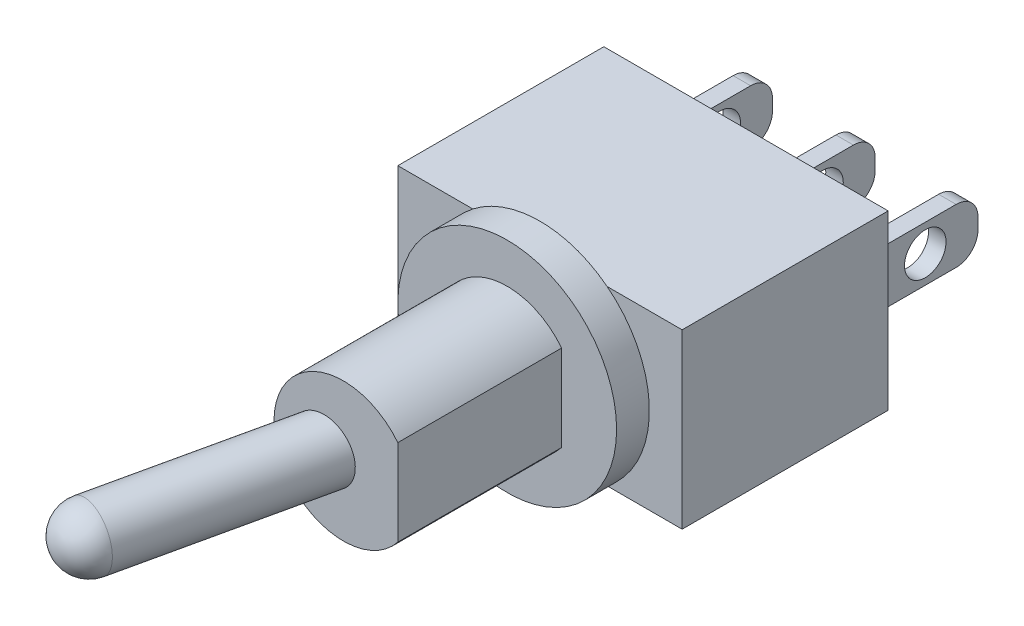
from build123d import *

# Parameters (mm, degrees)
SKETCH2_W           = 13.0048
SKETCH2_H           = 7.8994
BOSS_EXTRUDE1_DEPTH = 9.4234
BOSS_EXTRUDE2_START = 4.7
SKETCH5_R           = 0.95
BOSS_EXTRUDE2_DEPTH = 0.4
LPATTERN1_COUNT     = 3
LPATTERN1_PITCH     = 4.7
SKETCH6_R           = 5.0038
BOSS_EXTRUDE3_DEPTH = 1.4986
BOSS_EXTRUDE5_DEPTH = 7.493


with BuildPart() as part:
    # Sketch2 → Boss-Extrude1 (new body)
    with BuildSketch(Plane.XY):
        Rectangle(SKETCH2_W, SKETCH2_H)
    extrude(amount=-BOSS_EXTRUDE1_DEPTH)

    # Sketch5 → Boss-Extrude2 (add, symmetric)
    with BuildSketch(Plane(origin=(0, 0, 0), x_dir=(0, 0, -1), z_dir=(1, 0, 0)).offset(BOSS_EXTRUDE2_START)):
        with BuildLine():
            ThreePointArc((13.9352, 1.25), (14.642306781, 0.957106781), (14.9352, 0.25))
            Line((14.9352, 0.25), (14.9352, -0.25))
            ThreePointArc((14.9352, -0.25), (14.642306781, -0.957106781), (13.9352, -1.25))
            Line((13.9352, -1.25), (9.4234, -1.25))
            Line((9.4234, -1.25), (9.4234, 1.25))
            Line((9.4234, 1.25), (13.9352, 1.25))
        make_face()
        with Locations((12.5234, 0)):
            Circle(SKETCH5_R, mode=Mode.SUBTRACT)
    boss_extrude2 = extrude(amount=BOSS_EXTRUDE2_DEPTH, both=True)

    # LPattern1: Boss-Extrude2 ×3
    with Locations(*[(-i * LPATTERN1_PITCH, 0, 0) for i in range(1, LPATTERN1_COUNT)]):
        add(boss_extrude2)

    # Sketch6 → Boss-Extrude3 (add)
    with BuildSketch(Plane.XY):
        with Locations(Location((0, 0, 0), (0, 0, 127.876114344))):
            Circle(SKETCH6_R)
    extrude(amount=BOSS_EXTRUDE3_DEPTH)

    # Sketch7 → Boss-Extrude5 (add)
    with BuildSketch(Plane.XY.offset(1.4986)):
        with BuildLine():
            Line((2.4892, -1.970915615), (2.4892, 1.970915615))
            ThreePointArc((2.4892, 1.970915615), (-3.175, 0), (2.4892, -1.970915615))
        make_face()
    extrude(amount=BOSS_EXTRUDE5_DEPTH)

    # Sketch8 → Revolve1 (revolve)
    with BuildSketch(Plane(origin=(0, 0, 0), x_dir=(1, 0, 0), z_dir=(0, 1, 0))):
        with BuildLine():
            Line((-3.138374402, -19.147892103), (0, -4.9916))
            Line((0, -4.9916), (-1.363885522, -4.689233859))
            Line((-1.363885522, -4.689233859), (-4.199893783, -17.481640441))
            ThreePointArc((-4.199893783, -17.481640441), (-4.014226111, -18.534614134), (-3.138374402, -19.147892103))
        make_face()
    revolve(axis=Axis((-3.138374402, 0, 19.147892103), (0.21643961393810326, 0, -0.9762960071199334)))


solid = part.part
